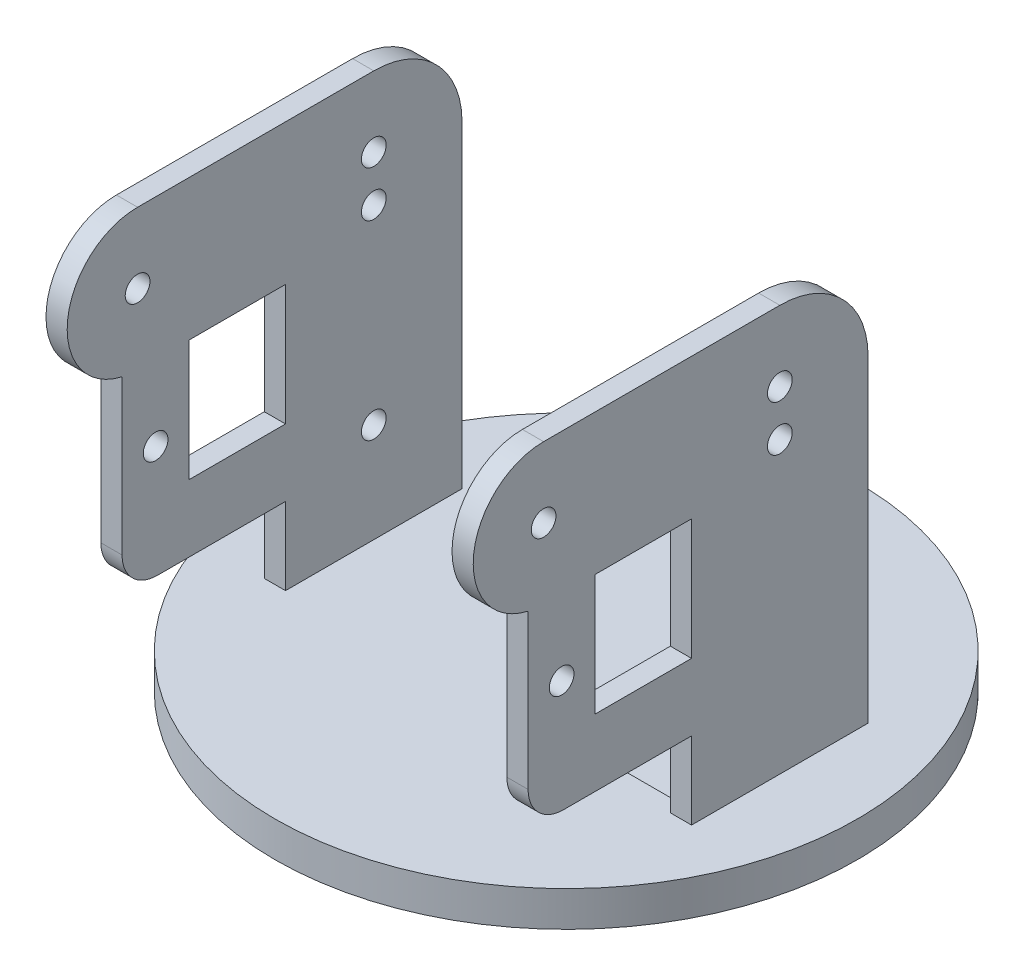
from build123d import *

# Parameters (mm, degrees)
ESQUISSE1_R             = 50.5
BOSS_EXTRU_1_DEPTH      = 15
ESQUISSE2_R             = 82.5
BOSS_EXTRU_2_DEPTH      = 10
ESQUISSE3_W             = 40.5
ESQUISSE3_H             = 42.5
ENL_V_MAT_EXTRU_1_DEPTH = 2
ESQUISSE4_W             = 10
ESQUISSE4_H             = 16
ENL_V_MAT_EXTRU_2_DEPTH = 6.3
ESQUISSE5_W             = 50
ESQUISSE5_H             = 90
BOSS_EXTRU_3_DEPTH      = 6
BOSS_EXTRU_4_DEPTH      = 6
ESQUISSE7_R             = 3.5
ENL_V_MAT_EXTRU_3_DEPTH = 10
ESQUISSE8_R             = 3.5
ENL_V_MAT_EXTRU_4_DEPTH = 6
ESQUISSE9_R             = 3.5
BOSS_EXTRU_5_DEPTH      = 6
ENL_V_START             = -6
ESQUISSE10_R            = 3.5
ENL_V_MAT_EXTRU_5_DEPTH = 6
ESQUISSE13_R            = 3.5
ENL_V_MAT_EXTRU_6_DEPTH = 10
ESQUISSE17_R            = 3.5
ENL_V_MAT_EXTRU_7_DEPTH = 6
ESQUISSE19_R            = 3.5
BOSS_EXTRU_8_DEPTH      = 6
CONG_1_R                = 10
CONG_1_OF_SYM_TRIE4_R   = 10


with BuildPart() as part:
    # Esquisse1 → Boss.-Extru.1 (new body)
    with BuildSketch(Plane(origin=(0, 0, 0), x_dir=(1, 0, 0), z_dir=(0, 1, 0))):
        with Locations(Location((0, 0, 0), (0, 0, 270))):
            Circle(ESQUISSE1_R)
    extrude(amount=BOSS_EXTRU_1_DEPTH)

    # Esquisse2 → Boss.-Extru.2 (add)
    with BuildSketch(Plane(origin=(0, 15, 0), x_dir=(1, 0, 0), z_dir=(0, 1, 0))):
        with Locations(Location((0, 0, 0), (0, 0, 270))):
            Circle(ESQUISSE2_R)
    extrude(amount=BOSS_EXTRU_2_DEPTH)

    # Esquisse3 → Enlèv. mat.-Extru.1 (cut)
    with BuildSketch(Plane(origin=(0, 25, 0), x_dir=(1, 0, 0), z_dir=(0, 1, 0))):
        with Locations((34.25, 0)):
            Rectangle(ESQUISSE3_W, ESQUISSE3_H)
    extrude(amount=-ENL_V_MAT_EXTRU_1_DEPTH, mode=Mode.SUBTRACT)

    # Esquisse4 → Enlèv. mat.-Extru.2 (cut)
    with BuildSketch(Plane(origin=(0, 23, 0), x_dir=(1, 0, 0), z_dir=(0, 1, 0))):
        with Locations((49.5, 0)):
            Rectangle(ESQUISSE4_W, ESQUISSE4_H)
    extrude(amount=-ENL_V_MAT_EXTRU_2_DEPTH, mode=Mode.SUBTRACT)

    # Esquisse5 → Boss.-Extru.3 (add)
    with BuildSketch(Plane.ZY.offset(-54.5)):
        with Locations((0, 70)):
            Rectangle(ESQUISSE5_W, ESQUISSE5_H)
        with BuildLine():
            ThreePointArc((25, 115), (0, 140), (-25, 115))
            Line((-25, 115), (25, 115))
        make_face()
    boss_extru_3 = extrude(amount=-BOSS_EXTRU_3_DEPTH)

    # Symétrie1: Boss.-Extru.3 across plane
    add(boss_extru_3.mirror(Plane(origin=(0, 0, 0), x_dir=(0, 0, 1), z_dir=(1, 0, 0))))

    # Esquisse6 → Boss.-Extru.4 (add)
    with BuildSketch(Plane.ZY.offset(-54.5)):
        with BuildLine():
            Line((66.9, 140), (0, 140))
            ThreePointArc((0, 140), (17.67766953, 132.67766953), (25, 115))
            Line((25, 115), (25, 100.126441606))
            Line((25, 100.126441606), (66.9, 100.126441606))
            Line((66.9, 100.126441606), (66.9, 140))
        make_face()
        with BuildLine():
            Line((66.9, 140), (66.9, 100.126441606))
            ThreePointArc((66.9, 100.126441606), (86.836779197, 120.063220803), (66.9, 140))
        make_face()
    extrude(amount=-BOSS_EXTRU_4_DEPTH)

    # Esquisse7 → Enlèv. mat.-Extru.3 (cut)
    with BuildSketch(Plane(origin=(60.5, 0, 0), x_dir=(0, 0, -1), z_dir=(1, 0, 0))):
        with Locations((-66.9, 120.063220803)):
            Circle(ESQUISSE7_R)
    extrude(amount=-ENL_V_MAT_EXTRU_3_DEPTH, mode=Mode.SUBTRACT)

    # Esquisse8 → Enlèv. mat.-Extru.4 (cut)
    with BuildSketch(Plane(origin=(60.5, 0, 0), x_dir=(0, 0, -1), z_dir=(1, 0, 0))):
        with Locations((0, 120.063220803)):
            Circle(ESQUISSE8_R)
    extrude(amount=-ENL_V_MAT_EXTRU_4_DEPTH, mode=Mode.SUBTRACT)

    # Esquisse9 → Boss.-Extru.5 (add)
    with BuildSketch(Plane.ZY.offset(60.5)):
        with BuildLine():
            Line((0, 140), (66.9, 140))
            ThreePointArc((66.9, 140), (86.836779197, 120.063220803), (66.9, 100.126441606))
            Line((66.9, 100.126441606), (25, 100.126441606))
            Line((25, 100.126441606), (25, 115))
            ThreePointArc((25, 115), (17.67766953, 132.67766953), (0, 140))
        make_face()
        with Locations(Location((66.9, 120.063220803, 0), (0, 0, 180))):
            Circle(ESQUISSE9_R, mode=Mode.SUBTRACT)
    extrude(amount=-BOSS_EXTRU_5_DEPTH)

    # Esquisse10 → Enlèv. mat.-Extru.5 (cut)
    with BuildSketch(Plane.ZY.offset(60.5).offset(ENL_V_START)):
        with Locations(Location((0, 120.063220803, 0), (0, 0, 180))):
            Circle(ESQUISSE10_R)
    extrude(amount=ENL_V_MAT_EXTRU_5_DEPTH, mode=Mode.SUBTRACT)

    # Esquisse13 → Enlèv. mat.-Extru.6 (cut)
    with BuildSketch(Plane.ZY.offset(60.5)):
        with Locations((0, 53.163220803)):
            Circle(ESQUISSE13_R)
    extrude(amount=-ENL_V_MAT_EXTRU_6_DEPTH, mode=Mode.SUBTRACT)

    # Esquisse17 → Enlèv. mat.-Extru.7 (cut)
    with BuildSketch(Plane.ZY.offset(60.5)):
        with Locations((0, 107.085063293)):
            Circle(ESQUISSE17_R)
    enl_v_mat_extru_7 = extrude(amount=-ENL_V_MAT_EXTRU_7_DEPTH, mode=Mode.SUBTRACT)

    # Esquisse19 → Boss.-Extru.8 (add)
    # profile 1 of 2: a face of its own
    with BuildSketch(Plane.ZY.offset(60.5)):
        with Locations((0, 61.406086298)):
            Circle(ESQUISSE19_R)
    # profile 2 of 2: a face of its own
    with BuildSketch(Plane.ZY.offset(60.5)):
        with BuildLine():
            Line((25, 46.888681), (71.2950306, 46.888681))
            Line((71.2950306, 46.888681), (71.2950306, 100.616913422))
            ThreePointArc((71.2950306, 100.616913422), (69.111156744, 100.249438968), (66.9, 100.126441606))
            Line((66.9, 100.126441606), (52.2950306, 100.126441606))
            Line((52.2950306, 100.126441606), (52.2950306, 65.888681))
            Line((52.2950306, 65.888681), (25, 65.888681))
            Line((25, 65.888681), (25, 46.888681))
        make_face()
        with Locations((61.7950306, 78.794182581)):
            Circle(ESQUISSE19_R, mode=Mode.SUBTRACT)
    boss_extru_8 = extrude(amount=-BOSS_EXTRU_8_DEPTH)

    # Congé1
    cong_1_edges = [part.edges().sort_by_distance(p)[0] for p in [
        (-57.5, 46.888681, 71.2950306),
    ]]
    fillet(cong_1_edges, radius=CONG_1_R)

    # Symétrie4: Enlèv. mat.-Extru.7, Boss.-Extru.8 across plane
    add(enl_v_mat_extru_7.mirror(Plane(origin=(0, 0, 0), x_dir=(0, 0, 1), z_dir=(1, 0, 0))), mode=Mode.SUBTRACT)
    add(boss_extru_8.mirror(Plane(origin=(0, 0, 0), x_dir=(0, 0, 1), z_dir=(1, 0, 0))))

    # Congé1 of Symétrie4
    cong_1_of_sym_trie4_edges = [part.edges().sort_by_distance(p)[0] for p in [
        (57.5, 46.888681, 71.2950306),
    ]]
    fillet(cong_1_of_sym_trie4_edges, radius=CONG_1_OF_SYM_TRIE4_R)


solid = part.part
